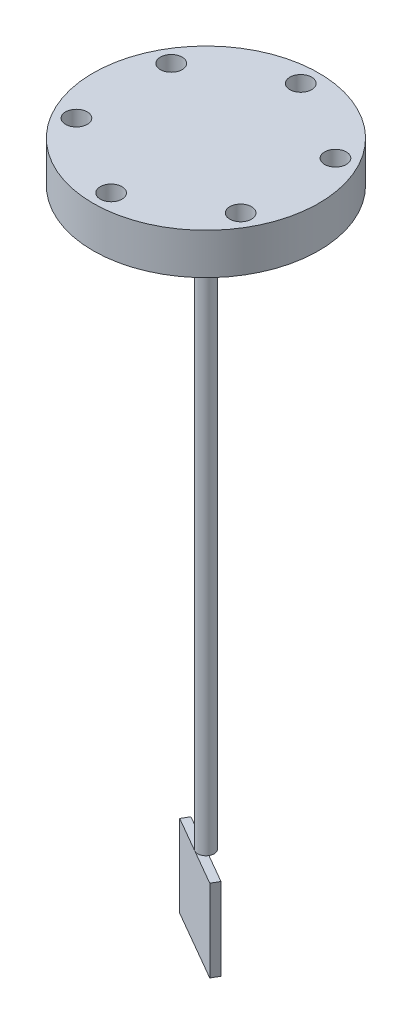
from build123d import *

# Parameters (mm, degrees)
SKETCH1_R           = 34.925
EXTRUDE1_DEPTH      = 12.7
SKETCH3_R           = 3.3655
CUT_EXTRUDE2_DEPTH  = 12.7
CIRPATTERN1_COUNT   = 6
SKETCH8_R           = 2.54
EXTRUDE3_DEPTH      = 177.8
EXTRUDE_THIN1_DEPTH = 25.4


with BuildPart() as part:
    # Sketch1 → Extrude1 (new body)
    with BuildSketch(Plane(origin=(0, 0, 0), x_dir=(1, 0, 0), z_dir=(0, 1, 0))):
        with Locations(Location((0, 0, 0), (0, 0, 270))):
            Circle(SKETCH1_R)
    extrude(amount=EXTRUDE1_DEPTH)

    # Sketch3 → Cut-Extrude2 (cut)
    with BuildSketch(Plane(origin=(0, 0, 0), x_dir=(1, 0, 0), z_dir=(0, 1, 0))):
        with Locations(Location((0, 29.337, 0), (0, 0, 270))):
            Circle(SKETCH3_R)
    cut_extrude2 = extrude(amount=CUT_EXTRUDE2_DEPTH, mode=Mode.SUBTRACT)

    # CirPattern1: Cut-Extrude2 ×6 about axis
    cirpattern1_axis = Axis((0, 0, 0), (0, 1, 0))
    for i in range(1, CIRPATTERN1_COUNT):
        add(cut_extrude2.rotate(cirpattern1_axis, i * 360 / CIRPATTERN1_COUNT), mode=Mode.SUBTRACT)

    # Sketch8 → Extrude3 (add)
    with BuildSketch(Plane.XZ):
        with Locations(Location((0, 0, 0), (0, 0, 90))):
            Circle(SKETCH8_R)
    extrude(amount=EXTRUDE3_DEPTH)

    # Sketch12 → Extrude-Thin1 (add)
    with BuildSketch(Plane.XZ.offset(177.8)):
        Polygon((10.998522628, 6.35), (0, 0), (-10.998522628, -6.35), (-12.268522628, -4.150295474), (-1.27, 2.199704526), (9.728522628, 8.549704526), align=None)
    extrude(amount=EXTRUDE_THIN1_DEPTH)


solid = part.part
